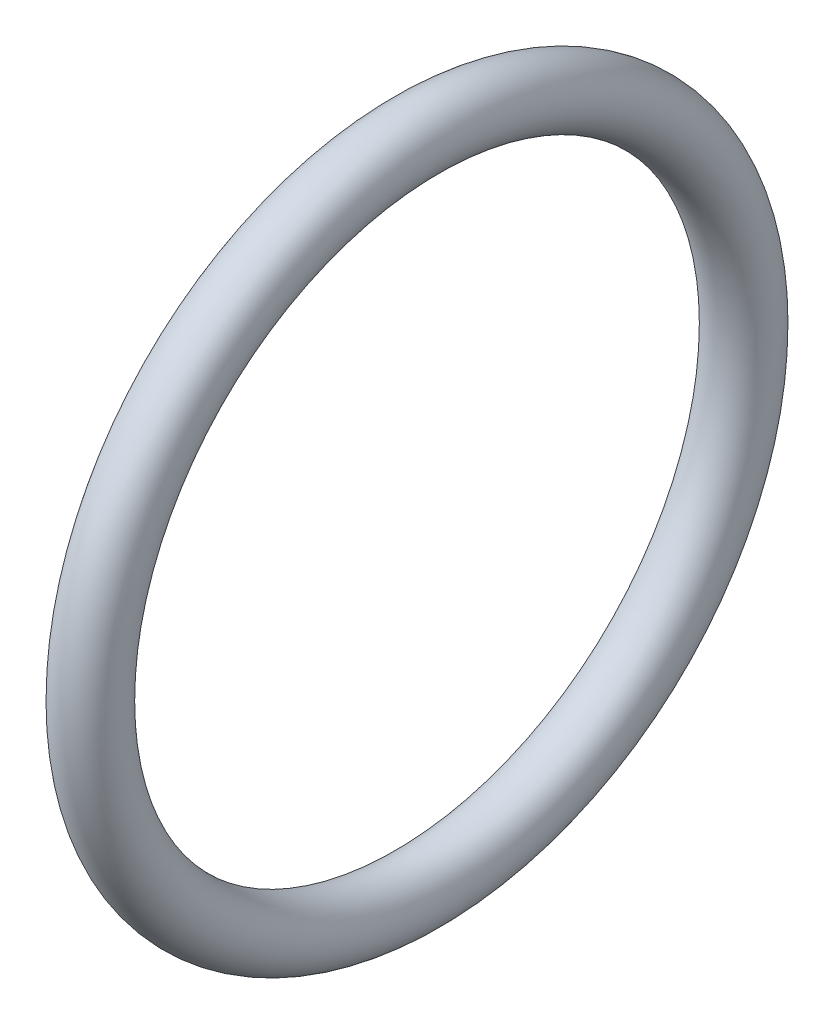
from build123d import *

# Parameters (mm, degrees)
SKETCH1_R = 2.5


with BuildPart() as part:
    # Sketch1 → Revolve1 (revolve)
    with BuildSketch(Plane.XY, mode=Mode.PRIVATE) as revolve1_sk:
        with Locations((1.698636188, 26.041451884)):
            Circle(SKETCH1_R)
    revolve(revolve1_sk.sketch.rotate(Axis((-8.977593231, 0, 0), (1, 0, 0)), 90), axis=Axis((-8.977593231, 0, 0), (1, 0, 0)))


solid = part.part
